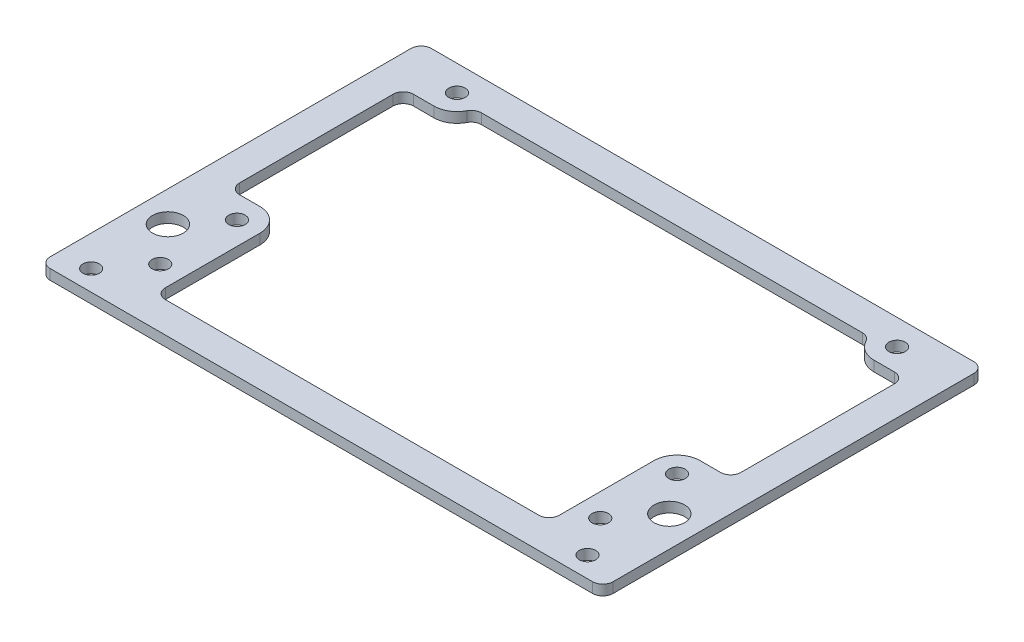
from build123d import *

# Parameters (mm, degrees)
SKETCH_1_W          = 110
SKETCH_1_H          = 79
SKETCH_1_R          = 1.6
EXTRUDE_1_DEPTH     = 2
SKETCH_3_W          = 110
SKETCH_3_H          = 1
EXTRUDE_2_DEPTH     = 2
SKETCH_4_R          = 1.6
CUT_EXTRUDE_2_DEPTH = 2
SKETCH_6_W          = 110
SKETCH_6_H          = 5.5
CUT_EXTRUDE_4_DEPTH = 2
SKETCH_7_R          = 3
CUT_EXTRUDE_5_DEPTH = 2
FILLET_2_R          = 2


with BuildPart() as part:
    # 草图1 → 凸台-拉伸1 (new body)
    with BuildSketch(Plane(origin=(0, 0, 0), x_dir=(1, 0, 0), z_dir=(0, 1, 0))):
        Rectangle(SKETCH_1_W, SKETCH_1_H)
        with Locations(Location((43, -29, 0), (0, 0, 270))):
            Circle(SKETCH_1_R, mode=Mode.SUBTRACT)
        with Locations(Location((-43, -29, 0), (0, 0, 270))):
            Circle(SKETCH_1_R, mode=Mode.SUBTRACT)
        with Locations(Location((-43, 29, 0), (0, 0, 270))):
            Circle(SKETCH_1_R, mode=Mode.SUBTRACT)
        with Locations(Location((43, 29, 0), (0, 0, 270))):
            Circle(SKETCH_1_R, mode=Mode.SUBTRACT)
        with Locations(Location((43, -14, 0), (0, 0, 270))):
            Circle(SKETCH_1_R, mode=Mode.SUBTRACT)
        with Locations(Location((-43, -14, 0), (0, 0, 270))):
            Circle(SKETCH_1_R, mode=Mode.SUBTRACT)
    extrude(amount=EXTRUDE_1_DEPTH)

    # 草图3 → 凸台-拉伸2 (add)
    with BuildSketch(Plane(origin=(0, 2, 0), x_dir=(1, 0, 0), z_dir=(0, 1, 0))):
        with Locations((0, -40)):
            Rectangle(SKETCH_3_W, SKETCH_3_H)
    extrude(amount=-EXTRUDE_2_DEPTH)

    # 草图4 → 切除-拉伸2 (cut)
    with BuildSketch(Plane(origin=(0, 2, 0), x_dir=(1, 0, 0), z_dir=(0, 1, 0))):
        with Locations(Location((48, -36.5, 0), (0, 0, 270))):
            Circle(SKETCH_4_R)
        with Locations(Location((-49, -36.5, 0), (0, 0, 270))):
            Circle(SKETCH_4_R)
    extrude(amount=-CUT_EXTRUDE_2_DEPTH, mode=Mode.SUBTRACT)

    # 草图6 → 切除-拉伸4 (cut)
    with BuildSketch(Plane(origin=(0, 2, 0), x_dir=(1, 0, 0), z_dir=(0, 1, 0))):
        with Locations((0, 36.75)):
            Rectangle(SKETCH_6_W, SKETCH_6_H)
        with BuildLine():
            Line((-38.612517806, 28), (38.612517806, 28))
            ThreePointArc((38.612517806, 28), (40.19375696, 25.48218818), (43, 24.5))
            Line((43, 24.5), (49, 24.5))
            Line((49, 24.5), (49, -9.5))
            Line((49, -9.5), (43, -9.5))
            ThreePointArc((43, -9.5), (39.818019485, -10.818019485), (38.5, -14))
            Line((38.5, -14), (38.5, -34.5))
            Line((38.5, -34.5), (-38.5, -34.5))
            Line((-38.5, -34.5), (-38.5, -14))
            ThreePointArc((-38.5, -14), (-39.818019485, -10.818019485), (-43, -9.5))
            Line((-43, -9.5), (-49, -9.5))
            Line((-49, -9.5), (-49, 24.5))
            Line((-49, 24.5), (-43, 24.5))
            ThreePointArc((-43, 24.5), (-40.19375696, 25.48218818), (-38.612517806, 28))
        make_face()
    extrude(amount=-CUT_EXTRUDE_4_DEPTH, mode=Mode.SUBTRACT)

    # 草图7 → 切除-拉伸5 (cut)
    with BuildSketch(Plane(origin=(0, 2, 0), x_dir=(1, 0, 0), z_dir=(0, 1, 0))):
        with Locations(Location((49, -21.5, 0), (0, 0, 270))):
            Circle(SKETCH_7_R)
        with Locations(Location((-49, -21.5, 0), (0, 0, 90))):
            Circle(SKETCH_7_R)
    extrude(amount=-CUT_EXTRUDE_5_DEPTH, mode=Mode.SUBTRACT)

    # 圆角2
    fillet_2_edges = [part.edges().sort_by_distance(p)[0] for p in [
        (-55, 1, 40.5),
        (55, 1, 40.5),
        (38.5, 1, 34.5),
        (-38.5, 1, 34.5),
        (-49, 1, 9.5),
        (-49, 1, -24.5),
        (-38.612517806, 1, -28),
        (38.612517806, 1, -28),
        (49, 1, -24.5),
        (49, 1, 9.5),
        (-55, 1, -34),
        (55, 1, -34),
    ]]
    fillet(fillet_2_edges, radius=FILLET_2_R)


solid = part.part
